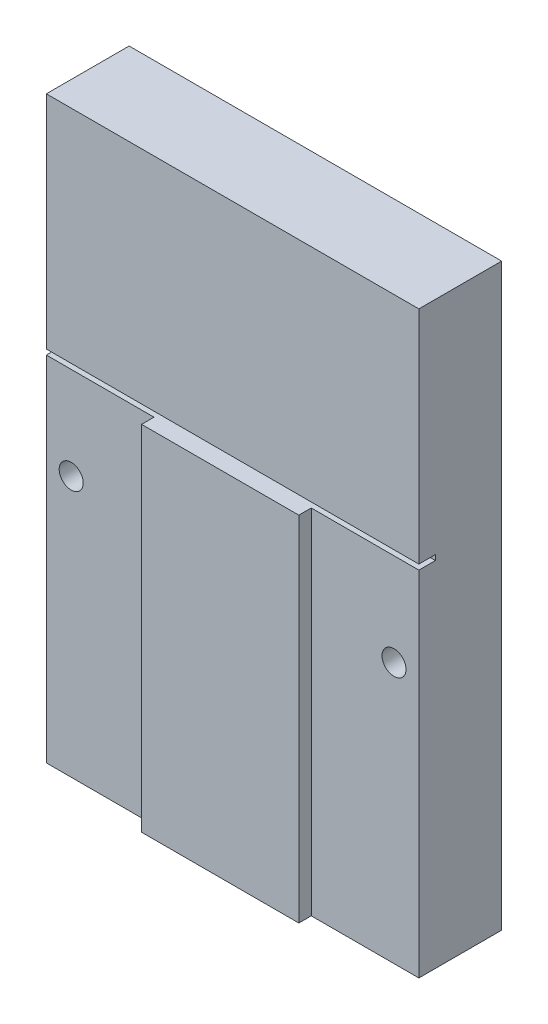
from build123d import *

# Parameters (mm, degrees)
SKETCH2_W           = 45
SKETCH2_H           = 10
BOSS_EXTRUDE1_DEPTH = 40
SKETCH4_W           = 45
SKETCH4_H           = 10
BOSS_EXTRUDE2_DEPTH = 10
SKETCH8_W           = 45
SKETCH8_H           = 10
BOSS_EXTRUDE3_DEPTH = 20
SKETCH9_R           = 1.45
CUT_EXTRUDE2_DEPTH  = 20
SKETCH10_W          = 45
SKETCH10_H          = 0.626165357
CUT_EXTRUDE3_DEPTH  = 2
SKETCH11_W          = 19
SKETCH11_H          = 42.671327575
BOSS_EXTRUDE4_DEPTH = 1.5


with BuildPart() as part:
    # Sketch2 → Boss-Extrude1 (new body)
    with BuildSketch(Plane(origin=(0, 0, 0), x_dir=(1, 0, 0), z_dir=(0, 1, 0))):
        Rectangle(SKETCH2_W, SKETCH2_H)
    extrude(amount=BOSS_EXTRUDE1_DEPTH)

    # Sketch4 → Boss-Extrude2 (add)
    with BuildSketch(Plane(origin=(0, 40, 0), x_dir=(1, 0, 0), z_dir=(0, 1, 0))):
        Rectangle(SKETCH4_W, SKETCH4_H)
    extrude(amount=BOSS_EXTRUDE2_DEPTH)

    # Sketch8 → Boss-Extrude3 (add)
    with BuildSketch(Plane.XZ):
        Rectangle(SKETCH8_W, SKETCH8_H)
    extrude(amount=BOSS_EXTRUDE3_DEPTH)

    # Sketch9 → Cut-Extrude2 (cut)
    with BuildSketch(Plane.XY.offset(5)):
        with Locations((19.5, 11.5)):
            Circle(SKETCH9_R)
        with Locations((-19.5, 11.5)):
            Circle(SKETCH9_R)
    extrude(amount=-CUT_EXTRUDE2_DEPTH, mode=Mode.SUBTRACT)

    # Sketch10 → Cut-Extrude3 (cut)
    with BuildSketch(Plane.XY.offset(5)):
        with Locations((0, 22.984410254)):
            Rectangle(SKETCH10_W, SKETCH10_H)
    extrude(amount=-CUT_EXTRUDE3_DEPTH, mode=Mode.SUBTRACT)

    # Sketch11 → Boss-Extrude4 (add)
    with BuildSketch(Plane.XY.offset(5)):
        with Locations((0, 1.335663788)):
            Rectangle(SKETCH11_W, SKETCH11_H)
    extrude(amount=BOSS_EXTRUDE4_DEPTH)


solid = part.part
